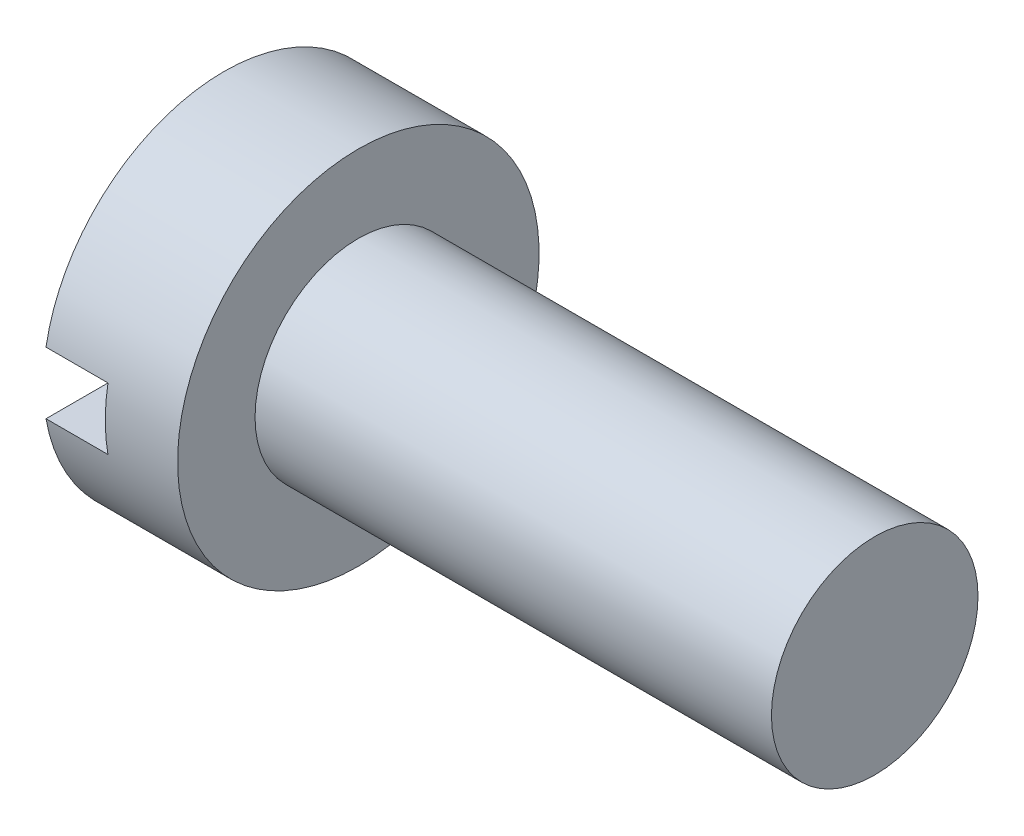
from build123d import *

# Parameters (mm, degrees)
SKETCH2_W          = 7
SKETCH2_H          = 1.2
CUT_EXTRUDE1_DEPTH = 1.2


with BuildPart() as part:
    # Sketch1 → Revolve1 (revolve)
    with BuildSketch(Plane.XY):
        Polygon((0, 0), (0, 3.5), (2.6, 3.5), (2.6, 2), (12.6, 2), (12.6, 0), align=None)
    revolve(axis=Axis((12.6, 0, 0), (-1, 0, 0)))

    # Sketch2 → Cut-Extrude1 (cut)
    with BuildSketch(Plane.ZY):
        Rectangle(SKETCH2_W, SKETCH2_H)
    extrude(amount=-CUT_EXTRUDE1_DEPTH, mode=Mode.SUBTRACT)


solid = part.part
